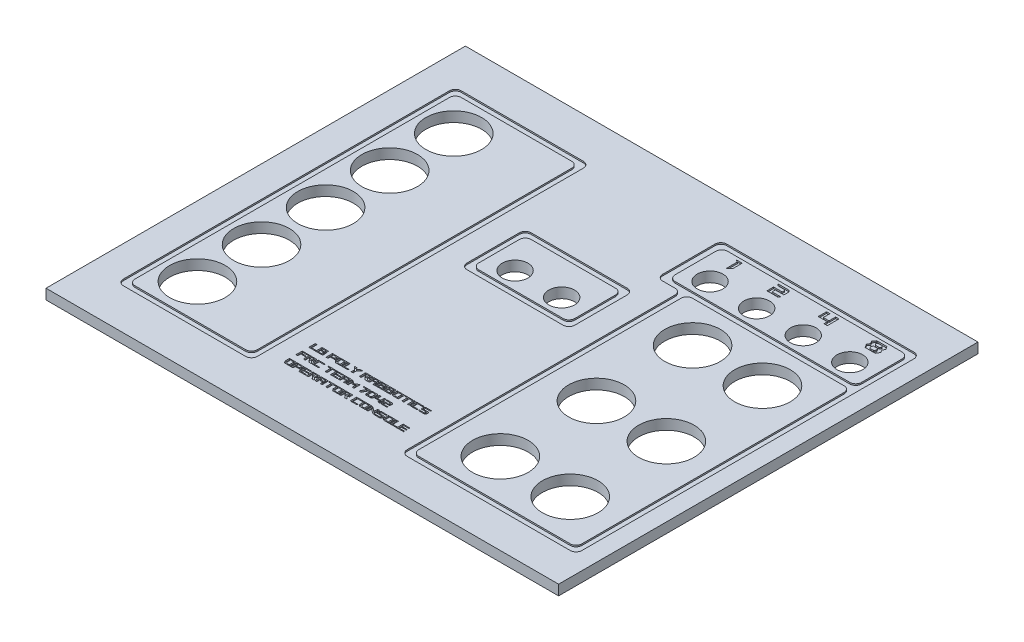
from build123d import *

# Parameters (mm, degrees)
SKETCH1_W           = 279.4
SKETCH1_H           = 228.6
BOSS_EXTRUDE1_DEPTH = 5.55625
SKETCH2_R           = 15.160625
CUT_EXTRUDE1_DEPTH  = 181.586411211
SKETCH3_R           = 7.0246875
SKETCH3_R_2         = 15.160625
CUT_EXTRUDE2_DEPTH  = 181.586411211
SKETCH4_W           = 73.025
SKETCH4_H           = 184.15
SKETCH4_W_2         = 66.675
SKETCH4_H_2         = 177.8
SKETCH4_W_3         = 88.9
SKETCH4_H_3         = 149.225
SKETCH4_W_4         = 101.6
SKETCH4_H_4         = 28.575
CUT_EXTRUDE3_DEPTH  = 0.79375
FILLET1_R           = 3.175
SKETCH5_W           = 1.743010591
SKETCH5_H           = 0.819065149
SKETCH5_H_2         = 1.141619432
SKETCH5_W_2         = 1.782964988
SKETCH5_H_3         = 1.234104295
SKETCH5_W_3         = 1.807936488
SKETCH5_H_4         = 0.965318114
SKETCH5_W_4         = 1.743010592
SKETCH5_W_5         = 1.049133865
SKETCH5_H_5         = 3.5
SKETCH5_W_6         = 1.807936487
SKETCH5_W_7         = 1.782964989
CUT_EXTRUDE4_DEPTH  = 0.79375
CUT_EXTRUDE5_DEPTH  = 0.79375
CUT_EXTRUDE6_DEPTH  = 0.79375
SKETCH8_R           = 7.0246875
CUT_EXTRUDE7_DEPTH  = 181.586411211


with BuildPart() as part:
    # Sketch1 → Boss-Extrude1 (new body)
    with BuildSketch(Plane(origin=(0, 0, 0), x_dir=(1, 0, 0), z_dir=(0, 1, 0))):
        Rectangle(SKETCH1_W, SKETCH1_H)
    extrude(amount=BOSS_EXTRUDE1_DEPTH)

    # Sketch2 → Cut-Extrude1 (cut, through all)
    with BuildSketch(Plane(origin=(0, 5.55625, 0), x_dir=(1, 0, 0), z_dir=(0, 1, 0))):
        with Locations(Location((-101.6, 69.85, 0), (0, 0, 270))):
            Circle(SKETCH2_R)
        with Locations(Location((-101.6, 34.925, 0), (0, 0, 270))):
            Circle(SKETCH2_R)
        with Locations(Location((-101.6, 0, 0), (0, 0, 270))):
            Circle(SKETCH2_R)
        with Locations(Location((-101.6, -34.925, 0), (0, 0, 270))):
            Circle(SKETCH2_R)
        with Locations(Location((-101.6, -69.85, 0), (0, 0, 270))):
            Circle(SKETCH2_R)
    extrude(amount=-CUT_EXTRUDE1_DEPTH, mode=Mode.SUBTRACT)

    # Sketch3 → Cut-Extrude2 (cut, through all)
    with BuildSketch(Plane(origin=(0, 5.55625, 0), x_dir=(1, 0, 0), z_dir=(0, 1, 0))):
        with Locations(Location((38.1, 69.85, 0), (0, 0, 270))):
            Circle(SKETCH3_R)
        with Locations(Location((63.5, 69.85, 0), (0, 0, 270))):
            Circle(SKETCH3_R)
        with Locations(Location((88.9, 69.85, 0), (0, 0, 270))):
            Circle(SKETCH3_R)
        with Locations(Location((114.3, 69.85, 0), (0, 0, 270))):
            Circle(SKETCH3_R)
        with Locations(Location((63.5, 34.925, 0), (0, 0, 270))):
            Circle(SKETCH3_R_2)
        with Locations(Location((101.6, 34.925, 0), (0, 0, 270))):
            Circle(SKETCH3_R_2)
        with Locations(Location((101.6, -17.4625, 0), (0, 0, 270))):
            Circle(SKETCH3_R_2)
        with Locations(Location((63.5, -17.4625, 0), (0, 0, 270))):
            Circle(SKETCH3_R_2)
        with Locations(Location((101.6, -69.85, 0), (0, 0, 270))):
            Circle(SKETCH3_R_2)
        with Locations(Location((63.5, -69.85, 0), (0, 0, 270))):
            Circle(SKETCH3_R_2)
    extrude(amount=-CUT_EXTRUDE2_DEPTH, mode=Mode.SUBTRACT)

    # Sketch4 → Cut-Extrude3 (cut)
    # profile 1 of 2: a face of its own
    with BuildSketch(Plane(origin=(0, 5.55625, 0), x_dir=(1, 0, 0), z_dir=(0, 1, 0))):
        with Locations((-86.439375, 0)):
            Rectangle(SKETCH4_W, SKETCH4_H)
        with Locations((-86.439375, 0)):
            Rectangle(SKETCH4_W_2, SKETCH4_H_2, mode=Mode.SUBTRACT)
    # profile 2 of 2: a face of its own
    with BuildSketch(Plane(origin=(0, 5.55625, 0), x_dir=(1, 0, 0), z_dir=(0, 1, 0))):
        Polygon((130.175, 60.325), (130.175, -95.25), (34.925, -95.25), (34.925, 57.15), (21.779463134, 57.15), (21.779463134, 92.075), (130.175, 92.075), align=None)
        with Locations((82.55, -17.4625)):
            Rectangle(SKETCH4_W_3, SKETCH4_H_3, mode=Mode.SUBTRACT)
        with Locations((76.2, 74.6125)):
            Rectangle(SKETCH4_W_4, SKETCH4_H_4, mode=Mode.SUBTRACT)
    extrude(amount=-CUT_EXTRUDE3_DEPTH, mode=Mode.SUBTRACT)

    # Fillet1
    fillet1_edges = [part.edges().sort_by_distance(p)[0] for p in [
        (-119.776875, 5.159375, -88.9),
        (-53.101875, 5.159375, -88.9),
        (-53.101875, 5.159375, 88.9),
        (-119.776875, 5.159375, 88.9),
        (21.779463134, 5.159375, -92.075),
        (130.175, 5.159375, -92.075),
        (130.175, 5.159375, 95.25),
        (34.925, 5.159375, 95.25),
        (34.925, 5.159375, -57.15),
        (21.779463134, 5.159375, -57.15),
        (127, 5.159375, -57.15),
        (127, 5.159375, 92.075),
        (38.1, 5.159375, 92.075),
        (38.1, 5.159375, -57.15),
        (25.4, 5.159375, -60.325),
        (25.4, 5.159375, -88.9),
        (127, 5.159375, -88.9),
        (127, 5.159375, -60.325),
        (-49.926875, 5.159375, -92.075),
        (-49.926875, 5.159375, 92.075),
        (-122.951875, 5.159375, 92.075),
        (-122.951875, 5.159375, -92.075),
    ]]
    fillet(fillet1_edges, radius=FILLET1_R)

    # Sketch5 → Cut-Extrude4 (cut)
    # profile 1 of 41: a face of its own
    with BuildSketch(Plane(origin=(0, 5.55625, 0), x_dir=(1, 0, 0), z_dir=(0, 1, 0))):
        Polygon((-36.802163997, -70.03379494), (-37.252626826, -70.54878923), (-40.209679135, -70.54878923), (-40.209679135, -67.04878923), (-39.163953361, -67.04878923), (-39.163953361, -70.03379494), align=None)
    # profile 2 of 41: a face of its own
    with BuildSketch(Plane(origin=(0, 5.55625, 0), x_dir=(1, 0, 0), z_dir=(0, 1, 0))):
        Polygon((-32.683092397, -70.55453218), (-36.513720258, -70.55453218), (-36.513720258, -67.04247403), (-32.987744678, -67.04247403), (-32.987744678, -68.375952047), (-32.683092397, -68.375952047), align=None)
        with Locations((-34.598406328, -67.966419473)):
            Rectangle(SKETCH5_W, SKETCH5_H, mode=Mode.SUBTRACT)
        with Locations((-34.598406328, -69.469309596)):
            Rectangle(SKETCH5_W, SKETCH5_H_2, mode=Mode.SUBTRACT)
    # profile 3 of 41: a face of its own
    with BuildSketch(Plane(origin=(0, 5.55625, 0), x_dir=(1, 0, 0), z_dir=(0, 1, 0))):
        Polygon((-29.773910712, -69.305977015), (-29.773910712, -70.544563338), (-30.822713646, -70.544563338), (-30.822713646, -67.043046984), (-26.952131388, -67.043046984), (-26.952131388, -69.305977015), align=None)
        with Locations((-28.892416817, -68.174511999)):
            Rectangle(SKETCH5_W_2, SKETCH5_H_3, mode=Mode.SUBTRACT)
    # profile 4 of 41: a face of its own
    with BuildSketch(Plane(origin=(0, 5.55625, 0), x_dir=(1, 0, 0), z_dir=(0, 1, 0))):
        Polygon((-22.605629343, -70.553124491), (-22.605629343, -67.044453969), (-26.568057888, -67.044453969), (-26.568057888, -69.594269754), (-25.714708614, -70.553124491), align=None)
        Polygon((-23.654763208, -67.547344949), (-23.654763208, -70.050234216), (-24.928968668, -70.050234216), (-25.518924023, -69.366287524), (-25.518924023, -67.547344949), align=None, mode=Mode.SUBTRACT)
    # profile 5 of 41: a face of its own
    with BuildSketch(Plane(origin=(0, 5.55625, 0), x_dir=(1, 0, 0), z_dir=(0, 1, 0))):
        Polygon((-18.813721064, -70.03379494), (-19.264183893, -70.54878923), (-22.221236202, -70.54878923), (-22.221236202, -67.04878923), (-21.175510428, -67.04878923), (-21.175510428, -70.03379494), align=None)
    # profile 6 of 41: a face of its own
    with BuildSketch(Plane(origin=(0, 5.55625, 0), x_dir=(1, 0, 0), z_dir=(0, 1, 0))):
        Polygon((-17.088287191, -70.553125196), (-16.039154031, -70.553125196), (-16.039154031, -68.905006299), (-14.401023733, -67.057115414), (-15.609644258, -67.057115414), (-16.563737545, -68.135884147), (-17.517796964, -67.057115414), (-18.726417488, -67.057115414), (-17.088287191, -68.905006299), align=None)
    # profile 7 of 41: a face of its own
    with BuildSketch(Plane(origin=(0, 5.55625, 0), x_dir=(1, 0, 0), z_dir=(0, 1, 0))):
        Polygon((-8.386582238, -70.573506709), (-9.620174261, -70.573506709), (-11.503025243, -68.425957843), (-9.735043154, -68.425957843), (-9.735043154, -67.599367375), (-11.635973953, -67.599367375), (-11.635973953, -70.573506709), (-12.694765486, -70.573506709), (-12.694765486, -67.084954507), (-8.706217418, -67.084954507), (-8.706217418, -68.940370711), (-9.814951949, -68.940370711), align=None)
    # profile 8 of 41: a face of its own
    with BuildSketch(Plane(origin=(0, 5.55625, 0), x_dir=(1, 0, 0), z_dir=(0, 1, 0))):
        Polygon((-4.199478651, -67.084954507), (-4.199478651, -70.572393964), (-5.248281586, -70.572393964), (-5.248281586, -69.084092657), (-7.096172471, -69.084092657), (-7.096172471, -70.572393964), (-8.164952604, -70.572393964), (-8.164952604, -67.084954507), align=None)
        with Locations((-6.177221328, -68.082026432)):
            Rectangle(SKETCH5_W_3, SKETCH5_H_4, mode=Mode.SUBTRACT)
    # profile 9 of 41: a face of its own
    with BuildSketch(Plane(origin=(0, 5.55625, 0), x_dir=(1, 0, 0), z_dir=(0, 1, 0))):
        Polygon((0.010555813, -70.55453218), (-3.820072048, -70.55453218), (-3.820072048, -67.04247403), (-0.294096468, -67.04247403), (-0.294096468, -68.375952047), (0.010555813, -68.375952047), align=None)
        with Locations((-1.904758118, -67.966419473)):
            Rectangle(SKETCH5_W, SKETCH5_H, mode=Mode.SUBTRACT)
        with Locations((-1.904758118, -69.469309596)):
            Rectangle(SKETCH5_W, SKETCH5_H_2, mode=Mode.SUBTRACT)
    # profile 10 of 41: a face of its own
    with BuildSketch(Plane(origin=(0, 5.55625, 0), x_dir=(1, 0, 0), z_dir=(0, 1, 0))):
        Polygon((4.218649146, -70.55453218), (0.388021286, -70.55453218), (0.388021286, -67.04247403), (3.913996865, -67.04247403), (3.913996865, -68.375952047), (4.218649146, -68.375952047), align=None)
        with Locations((2.303335216, -67.966419473)):
            Rectangle(SKETCH5_W_4, SKETCH5_H, mode=Mode.SUBTRACT)
        with Locations((2.303335216, -69.469309596)):
            Rectangle(SKETCH5_W_4, SKETCH5_H_2, mode=Mode.SUBTRACT)
    # profile 11 of 41: a face of its own
    with BuildSketch(Plane(origin=(0, 5.55625, 0), x_dir=(1, 0, 0), z_dir=(0, 1, 0))):
        Polygon((8.562006998, -70.553124491), (8.562006998, -67.044453969), (4.599578454, -67.044453969), (4.599578454, -69.594269754), (5.452927727, -70.553124491), align=None)
        Polygon((7.512873133, -67.547344949), (7.512873133, -70.050234216), (6.238667674, -70.050234216), (5.648712319, -69.366287524), (5.648712319, -67.547344949), align=None, mode=Mode.SUBTRACT)
    # profile 12 of 41: a face of its own
    with BuildSketch(Plane(origin=(0, 5.55625, 0), x_dir=(1, 0, 0), z_dir=(0, 1, 0))):
        Polygon((12.839335381, -67.563822328), (11.5483703, -67.563822328), (11.5483703, -70.54878923), (10.506626277, -70.54878923), (10.506626277, -67.563822328), (9.200707932, -67.563822328), (8.757094448, -67.04878923), (13.28310551, -67.04878923), align=None)
    # profile 13 of 41: a face of its own
    with BuildSketch(Plane(origin=(0, 5.55625, 0), x_dir=(1, 0, 0), z_dir=(0, 1, 0))):
        with Locations((14.09524546, -68.79878923)):
            Rectangle(SKETCH5_W_5, SKETCH5_H_5)
    # profile 14 of 41: a face of its own
    with BuildSketch(Plane(origin=(0, 5.55625, 0), x_dir=(1, 0, 0), z_dir=(0, 1, 0))):
        Polygon((19.063454202, -70.03379494), (18.615261317, -70.54878923), (15.138597919, -70.54878923), (15.138597919, -67.04878923), (19.058560804, -67.04878923), (18.615261317, -67.563822328), (16.204509047, -67.563822328), (16.204509047, -70.03379494), align=None)
    # profile 15 of 41: a face of its own
    with BuildSketch(Plane(origin=(0, 5.55625, 0), x_dir=(1, 0, 0), z_dir=(0, 1, 0))):
        Polygon((23.383155104, -70.029679123), (22.930792776, -70.558867441), (19.794082567, -70.558867441), (19.346691253, -70.044454573), (22.14537247, -70.044454573), (22.32930001, -69.832673123), (22.32930001, -69.079135754), (19.480908647, -69.079135754), (19.480908647, -67.638932277), (19.953155034, -67.084954507), (23.50276075, -67.084954507), (23.06501017, -67.599367375), (20.743546354, -67.599367375), (20.519850698, -67.85180601), (20.519850698, -68.564685489), (23.383155104, -68.564685489), align=None)
    # profile 16 of 41: a face of its own
    with BuildSketch(Plane(origin=(0, 5.55625, 0), x_dir=(1, 0, 0), z_dir=(0, 1, 0))):
        Polygon((-39.190410166, -75.905689832), (-39.190410166, -77.568791629), (-40.209679135, -77.568791629), (-40.209679135, -74.096516413), (-36.432222432, -74.096516413), (-36.872072903, -74.610929281), (-39.190410166, -74.610929281), (-39.190410166, -75.391276965), (-36.577284329, -75.391276965), (-37.026961815, -75.905689832), align=None)
    # profile 17 of 41: a face of its own
    with BuildSketch(Plane(origin=(0, 5.55625, 0), x_dir=(1, 0, 0), z_dir=(0, 1, 0))):
        Polygon((-31.83167367, -77.585068614), (-33.065265693, -77.585068614), (-34.948116675, -75.437519748), (-33.180134585, -75.437519748), (-33.180134585, -74.610929281), (-35.081065384, -74.610929281), (-35.081065384, -77.585068614), (-36.139856918, -77.585068614), (-36.139856918, -74.096516413), (-32.15130885, -74.096516413), (-32.15130885, -75.951932616), (-33.26004338, -75.951932616), align=None)
    # profile 18 of 41: a face of its own
    with BuildSketch(Plane(origin=(0, 5.55625, 0), x_dir=(1, 0, 0), z_dir=(0, 1, 0))):
        Polygon((-27.68800031, -77.045356846), (-28.136193195, -77.560351135), (-31.612856593, -77.560351135), (-31.612856593, -74.060351135), (-27.692893708, -74.060351135), (-28.136193195, -74.575384233), (-30.546945465, -74.575384233), (-30.546945465, -77.045356846), align=None)
    # profile 19 of 41: a face of its own
    with BuildSketch(Plane(origin=(0, 5.55625, 0), x_dir=(1, 0, 0), z_dir=(0, 1, 0))):
        Polygon((-21.981480887, -74.575384233), (-23.272445969, -74.575384233), (-23.272445969, -77.560351135), (-24.314189992, -77.560351135), (-24.314189992, -74.575384233), (-25.620108337, -74.575384233), (-26.06372182, -74.060351135), (-21.537710758, -74.060351135), align=None)
    # profile 20 of 41: a face of its own
    with BuildSketch(Plane(origin=(0, 5.55625, 0), x_dir=(1, 0, 0), z_dir=(0, 1, 0))):
        Polygon((-17.881404278, -77.056016479), (-17.431980811, -77.570429347), (-21.346958569, -77.570429347), (-21.346958569, -74.096516413), (-17.422102287, -74.096516413), (-17.866423496, -74.610929281), (-20.298303813, -74.610929281), (-20.298303813, -75.576247395), (-17.656692545, -75.576247395), (-17.656692545, -76.09069766), (-20.298303813, -76.09069766), (-20.298303813, -77.056016479), align=None)
    # profile 21 of 41: a face of its own
    with BuildSketch(Plane(origin=(0, 5.55625, 0), x_dir=(1, 0, 0), z_dir=(0, 1, 0))):
        Polygon((-13.170578726, -74.096516413), (-13.170578726, -77.583955869), (-14.21938166, -77.583955869), (-14.21938166, -76.095654562), (-16.067272545, -76.095654562), (-16.067272545, -77.583955869), (-17.136052678, -77.583955869), (-17.136052678, -74.096516413), align=None)
        with Locations((-15.148321403, -75.093588338)):
            Rectangle(SKETCH5_W_6, SKETCH5_H_4, mode=Mode.SUBTRACT)
    # profile 22 of 41: a face of its own
    with BuildSketch(Plane(origin=(0, 5.55625, 0), x_dir=(1, 0, 0), z_dir=(0, 1, 0))):
        Polygon((-12.79204355, -77.560351135), (-12.79204355, -74.060351135), (-10.64467038, -75.46037442), (-8.497245702, -74.060351135), (-8.497245702, -77.560351135), (-9.528634209, -77.560351135), (-9.528634209, -75.555373367), (-10.64467038, -76.265365494), (-11.750741943, -75.555373367), (-11.750741943, -77.560351135), align=None)
    # profile 23 of 41: a face of its own
    with BuildSketch(Plane(origin=(0, 5.55625, 0), x_dir=(1, 0, 0), z_dir=(0, 1, 0))):
        Polygon((-5.907196803, -77.564687102), (-4.701469275, -77.564687102), (-2.855625362, -74.056015874), (-6.780480939, -74.056015874), (-6.338877029, -74.558906855), (-4.438491666, -74.558906855), align=None)
    # profile 24 of 41: a face of its own
    with BuildSketch(Plane(origin=(0, 5.55625, 0), x_dir=(1, 0, 0), z_dir=(0, 1, 0))):
        Polygon((1.259981699, -74.609532881), (0.796130647, -74.056015874), (-2.196113199, -74.056015874), (-2.664873878, -74.609532881), (-2.664873878, -77.01133803), (-2.196113199, -77.564686396), (0.796130647, -77.564686396), (1.259981699, -77.01133803), align=None)
        Polygon((0.248420801, -74.851731719), (0.248420801, -76.759047573), (-0.004468012, -77.061796121), (-1.395364246, -77.061796121), (-1.653312275, -76.759047573), (-1.653312275, -74.851731719), (-1.395364246, -74.558906855), (-0.004468012, -74.558906855), align=None, mode=Mode.SUBTRACT)
    # profile 25 of 41: a face of its own
    with BuildSketch(Plane(origin=(0, 5.55625, 0), x_dir=(1, 0, 0), z_dir=(0, 1, 0))):
        Polygon((4.410271351, -77.564687102), (5.421832955, -77.564687102), (5.421832955, -74.066712199), (4.410271351, -74.066712199), (4.410271351, -76.044454876), (2.693509411, -76.044454876), (2.693509411, -74.066712199), (1.681947807, -74.066712199), (1.681947807, -76.547345856), (4.410271351, -76.547345856), align=None)
    # profile 26 of 41: a face of its own
    with BuildSketch(Plane(origin=(0, 5.55625, 0), x_dir=(1, 0, 0), z_dir=(0, 1, 0))):
        Polygon((9.180457662, -77.570429347), (5.871108244, -77.570429347), (5.871108244, -75.576247395), (8.451701983, -75.576247395), (8.451701983, -74.863367916), (8.227085507, -74.610929281), (6.190562788, -74.610929281), (5.75131279, -74.096516413), (9.02073039, -74.096516413), (9.494920729, -74.650494182), (9.494920729, -76.09069766), (6.929301421, -76.09069766), (6.929301421, -77.056016479), (9.629925583, -77.056016479), align=None)
    # profile 27 of 41: a face of its own
    with BuildSketch(Plane(origin=(0, 5.55625, 0), x_dir=(1, 0, 0), z_dir=(0, 1, 0))):
        Polygon((-36.247250591, -84.576248302), (-36.247250591, -81.06757778), (-40.209679135, -81.06757778), (-40.209679135, -83.617393565), (-39.356329862, -84.576248302), align=None)
        Polygon((-37.296384456, -81.57046876), (-37.296384456, -84.073358027), (-38.570589915, -84.073358027), (-39.16054527, -83.389411335), (-39.16054527, -81.57046876), align=None, mode=Mode.SUBTRACT)
    # profile 28 of 41: a face of its own
    with BuildSketch(Plane(origin=(0, 5.55625, 0), x_dir=(1, 0, 0), z_dir=(0, 1, 0))):
        Polygon((-34.814374156, -83.329100826), (-34.814374156, -84.567687149), (-35.86317709, -84.567687149), (-35.86317709, -81.066170796), (-31.992594832, -81.066170796), (-31.992594832, -83.329100826), align=None)
        with Locations((-33.93288026, -82.197635812)):
            Rectangle(SKETCH5_W_7, SKETCH5_H_3, mode=Mode.SUBTRACT)
    # profile 29 of 41: a face of its own
    with BuildSketch(Plane(origin=(0, 5.55625, 0), x_dir=(1, 0, 0), z_dir=(0, 1, 0))):
        Polygon((-28.147302302, -84.067578385), (-27.697878834, -84.581991252), (-31.612856593, -84.581991252), (-31.612856593, -81.108078319), (-27.68800031, -81.108078319), (-28.132321519, -81.622491186), (-30.564201836, -81.622491186), (-30.564201836, -82.5878093), (-27.922590568, -82.5878093), (-27.922590568, -83.102259565), (-30.564201836, -83.102259565), (-30.564201836, -84.067578385), align=None)
    # profile 30 of 41: a face of its own
    with BuildSketch(Plane(origin=(0, 5.55625, 0), x_dir=(1, 0, 0), z_dir=(0, 1, 0))):
        Polygon((-23.091787515, -84.59663052), (-24.325379538, -84.59663052), (-26.20823052, -82.449081654), (-24.44024843, -82.449081654), (-24.44024843, -81.622491186), (-26.341179229, -81.622491186), (-26.341179229, -84.59663052), (-27.399970763, -84.59663052), (-27.399970763, -81.108078319), (-23.411422695, -81.108078319), (-23.411422695, -82.963494522), (-24.520157225, -82.963494522), align=None)
    # profile 31 of 41: a face of its own
    with BuildSketch(Plane(origin=(0, 5.55625, 0), x_dir=(1, 0, 0), z_dir=(0, 1, 0))):
        Polygon((-18.904683928, -81.108078319), (-18.904683928, -84.595517775), (-19.953486863, -84.595517775), (-19.953486863, -83.107216468), (-21.801377747, -83.107216468), (-21.801377747, -84.595517775), (-22.870157881, -84.595517775), (-22.870157881, -81.108078319), align=None)
        with Locations((-20.882426605, -82.105150243)):
            Rectangle(SKETCH5_W_6, SKETCH5_H_4, mode=Mode.SUBTRACT)
    # profile 32 of 41: a face of its own
    with BuildSketch(Plane(origin=(0, 5.55625, 0), x_dir=(1, 0, 0), z_dir=(0, 1, 0))):
        Polygon((-14.628878249, -81.586946139), (-15.91984333, -81.586946139), (-15.91984333, -84.571913041), (-16.961587353, -84.571913041), (-16.961587353, -81.586946139), (-18.267505698, -81.586946139), (-18.711119182, -81.071913041), (-14.18510812, -81.071913041), align=None)
    # profile 33 of 41: a face of its own
    with BuildSketch(Plane(origin=(0, 5.55625, 0), x_dir=(1, 0, 0), z_dir=(0, 1, 0))):
        Polygon((-10.027592125, -84.576248302), (-10.027592125, -81.06757778), (-13.99002067, -81.06757778), (-13.99002067, -83.617393565), (-13.136671397, -84.576248302), align=None)
        Polygon((-11.076725991, -81.57046876), (-11.076725991, -84.073358027), (-12.35093145, -84.073358027), (-12.940886805, -83.389411335), (-12.940886805, -81.57046876), align=None, mode=Mode.SUBTRACT)
    # profile 34 of 41: a face of its own
    with BuildSketch(Plane(origin=(0, 5.55625, 0), x_dir=(1, 0, 0), z_dir=(0, 1, 0))):
        Polygon((-5.334558501, -84.59663052), (-6.568150524, -84.59663052), (-8.451001507, -82.449081654), (-6.683019417, -82.449081654), (-6.683019417, -81.622491186), (-8.583950216, -81.622491186), (-8.583950216, -84.59663052), (-9.64274175, -84.59663052), (-9.64274175, -81.108078319), (-5.654193681, -81.108078319), (-5.654193681, -82.963494522), (-6.762928212, -82.963494522), align=None)
    # profile 35 of 41: a face of its own
    with BuildSketch(Plane(origin=(0, 5.55625, 0), x_dir=(1, 0, 0), z_dir=(0, 1, 0))):
        Polygon((0.288883943, -84.056918751), (-0.159308942, -84.571913041), (-3.63597234, -84.571913041), (-3.63597234, -81.071913041), (0.283990545, -81.071913041), (-0.159308942, -81.586946139), (-2.570061212, -81.586946139), (-2.570061212, -84.056918751), align=None)
    # profile 36 of 41: a face of its own
    with BuildSketch(Plane(origin=(0, 5.55625, 0), x_dir=(1, 0, 0), z_dir=(0, 1, 0))):
        Polygon((4.585127584, -84.576248302), (4.585127584, -81.06757778), (0.622699039, -81.06757778), (0.622699039, -83.617393565), (1.476048312, -84.576248302), align=None)
        Polygon((3.535993718, -81.57046876), (3.535993718, -84.073358027), (2.261788259, -84.073358027), (1.671832904, -83.389411335), (1.671832904, -81.57046876), align=None, mode=Mode.SUBTRACT)
    # profile 37 of 41: a face of its own
    with BuildSketch(Plane(origin=(0, 5.55625, 0), x_dir=(1, 0, 0), z_dir=(0, 1, 0))):
        Polygon((8.890041041, -84.571913041), (6.048010742, -82.666934164), (6.048010742, -84.571913041), (5.011428248, -84.571913041), (5.011428248, -81.071913041), (7.868229763, -82.961930893), (7.868229763, -81.071913041), (8.890041041, -81.071913041), align=None)
    # profile 38 of 41: a face of its own
    with BuildSketch(Plane(origin=(0, 5.55625, 0), x_dir=(1, 0, 0), z_dir=(0, 1, 0))):
        Polygon((13.255985433, -84.052802935), (12.803623104, -84.581991252), (9.666912895, -84.581991252), (9.219521581, -84.067578385), (12.018202798, -84.067578385), (12.202130338, -83.855796934), (12.202130338, -83.102259565), (9.353738975, -83.102259565), (9.353738975, -81.662056088), (9.825985362, -81.108078319), (13.375591078, -81.108078319), (12.937840498, -81.622491186), (10.616376683, -81.622491186), (10.392681026, -81.874929821), (10.392681026, -82.5878093), (13.255985433, -82.5878093), align=None)
    # profile 39 of 41: a face of its own
    with BuildSketch(Plane(origin=(0, 5.55625, 0), x_dir=(1, 0, 0), z_dir=(0, 1, 0))):
        Polygon((17.671835424, -84.576248302), (17.671835424, -81.06757778), (13.70940688, -81.06757778), (13.70940688, -83.617393565), (14.562756153, -84.576248302), align=None)
        Polygon((16.622701559, -81.57046876), (16.622701559, -84.073358027), (15.3484961, -84.073358027), (14.758540745, -83.389411335), (14.758540745, -81.57046876), align=None, mode=Mode.SUBTRACT)
    # profile 40 of 41: a face of its own
    with BuildSketch(Plane(origin=(0, 5.55625, 0), x_dir=(1, 0, 0), z_dir=(0, 1, 0))):
        Polygon((21.463743703, -84.056918751), (21.013280874, -84.571913041), (18.056228565, -84.571913041), (18.056228565, -81.071913041), (19.101954339, -81.071913041), (19.101954339, -84.056918751), align=None)
    # profile 41 of 41: a face of its own
    with BuildSketch(Plane(origin=(0, 5.55625, 0), x_dir=(1, 0, 0), z_dir=(0, 1, 0))):
        Polygon((25.216870306, -84.067578385), (25.666293774, -84.581991252), (21.751316015, -84.581991252), (21.751316015, -81.108078319), (25.676172298, -81.108078319), (25.231851089, -81.622491186), (22.799970772, -81.622491186), (22.799970772, -82.5878093), (25.44158204, -82.5878093), (25.44158204, -83.102259565), (22.799970772, -83.102259565), (22.799970772, -84.067578385), align=None)
    extrude(amount=-CUT_EXTRUDE4_DEPTH, mode=Mode.SUBTRACT)

    # Sketch6 → Cut-Extrude5 (cut)
    # profile 1 of 4: a face of its own
    with BuildSketch(Plane(origin=(0, 5.55625, 0), x_dir=(1, 0, 0), z_dir=(0, 1, 0))):
        Polygon((36.349512189, 86.430530343), (34.879649813, 87.249576783), (38.225068778, 87.249576783), (38.225068778, 82.021334949), (36.349512189, 80.212665002), align=None)
    # profile 2 of 4: a face of its own
    with BuildSketch(Plane(origin=(0, 5.55625, 0), x_dir=(1, 0, 0), z_dir=(0, 1, 0))):
        Polygon((64.005149228, 80.957324248), (58.001043854, 80.957324248), (58.001043854, 84.575340076), (62.682978211, 84.575340076), (62.682978211, 85.86870713), (62.275459746, 86.326702939), (58.58062567, 86.326702939), (57.783700673, 87.259994857), (63.71535832, 87.259994857), (64.575675078, 86.254920904), (64.575675078, 83.641980309), (59.920908619, 83.641980309), (59.920908619, 81.890616165), (64.820612455, 81.890616165), align=None)
    # profile 3 of 4: a face of its own
    with BuildSketch(Plane(origin=(0, 5.55625, 0), x_dir=(1, 0, 0), z_dir=(0, 1, 0))):
        Polygon((89.077512473, 80.967742321), (90.912774239, 80.967742321), (90.912774239, 87.314068216), (89.077512473, 87.314068216), (89.077512473, 83.725877931), (85.96281581, 83.725877931), (85.96281581, 87.314068216), (84.127554044, 87.314068216), (84.127554044, 82.81349001), (89.077512473, 82.81349001), align=None)
    # profile 4 of 4: a face of its own
    with BuildSketch(Plane(origin=(0, 5.55625, 0), x_dir=(1, 0, 0), z_dir=(0, 1, 0))):
        Polygon((118.179500174, 82.933671664), (117.229695264, 84.39132372), (118.179500174, 85.609481708), (116.994606282, 87.333474406), (111.488098965, 87.333474406), (110.30361217, 85.609481708), (111.253009983, 84.39132372), (110.30361217, 82.933671664), (111.488098965, 80.967743601), (116.994606282, 80.967743601), align=None)
        Polygon((112.564083154, 85.609481708), (113.187973145, 86.421086484), (115.294732102, 86.421086484), (115.918622094, 85.609481708), (115.294732102, 84.81654702), (113.187973145, 84.81654702), align=None, mode=Mode.SUBTRACT)
        Polygon((115.918622094, 82.933671664), (115.285690218, 81.880130243), (113.197015029, 81.880130243), (112.564083154, 82.952154846), (113.169889377, 83.904159098), (115.31281587, 83.904159098), align=None, mode=Mode.SUBTRACT)
    extrude(amount=-CUT_EXTRUDE5_DEPTH, mode=Mode.SUBTRACT)

    # Sketch7 → Cut-Extrude6 (cut)
    with BuildSketch(Plane(origin=(0, 5.55625, 0), x_dir=(1, 0, 0), z_dir=(0, 1, 0))):
        with BuildLine():
            Line((-33.6946875, 44.0928125), (18.6928125, 44.0928125))
            ThreePointArc((18.6928125, 44.0928125), (20.93787653, 43.16287653), (21.8678125, 40.9178125))
            Line((21.8678125, 40.9178125), (21.8678125, 12.3428125))
            ThreePointArc((21.8678125, 12.3428125), (20.93787653, 10.09774847), (18.6928125, 9.1678125))
            Line((18.6928125, 9.1678125), (-33.6946875, 9.1678125))
            ThreePointArc((-33.6946875, 9.1678125), (-35.93975153, 10.09774847), (-36.8696875, 12.3428125))
            Line((-36.8696875, 12.3428125), (-36.8696875, 40.9178125))
            ThreePointArc((-36.8696875, 40.9178125), (-35.93975153, 43.16287653), (-33.6946875, 44.0928125))
        make_face()
        with BuildLine():
            Line((-30.5196875, 40.9178125), (15.5178125, 40.9178125))
            ThreePointArc((15.5178125, 40.9178125), (17.76287653, 39.98787653), (18.6928125, 37.7428125))
            Line((18.6928125, 37.7428125), (18.6928125, 15.5178125))
            ThreePointArc((18.6928125, 15.5178125), (17.76287653, 13.27274847), (15.5178125, 12.3428125))
            Line((15.5178125, 12.3428125), (-30.5196875, 12.3428125))
            ThreePointArc((-30.5196875, 12.3428125), (-32.76475153, 13.27274847), (-33.6946875, 15.5178125))
            Line((-33.6946875, 15.5178125), (-33.6946875, 37.7428125))
            ThreePointArc((-33.6946875, 37.7428125), (-32.76475153, 39.98787653), (-30.5196875, 40.9178125))
        make_face(mode=Mode.SUBTRACT)
    extrude(amount=-CUT_EXTRUDE6_DEPTH, mode=Mode.SUBTRACT)

    # Sketch8 → Cut-Extrude7 (cut, through all)
    with BuildSketch(Plane(origin=(0, 5.55625, 0), x_dir=(1, 0, 0), z_dir=(0, 1, 0))):
        with Locations(Location((-20.2009375, 21.8678125, 0), (0, 0, 270))):
            Circle(SKETCH8_R)
        with Locations(Location((5.1990625, 21.8678125, 0), (0, 0, 270))):
            Circle(SKETCH8_R)
    extrude(amount=-CUT_EXTRUDE7_DEPTH, mode=Mode.SUBTRACT)


solid = part.part
